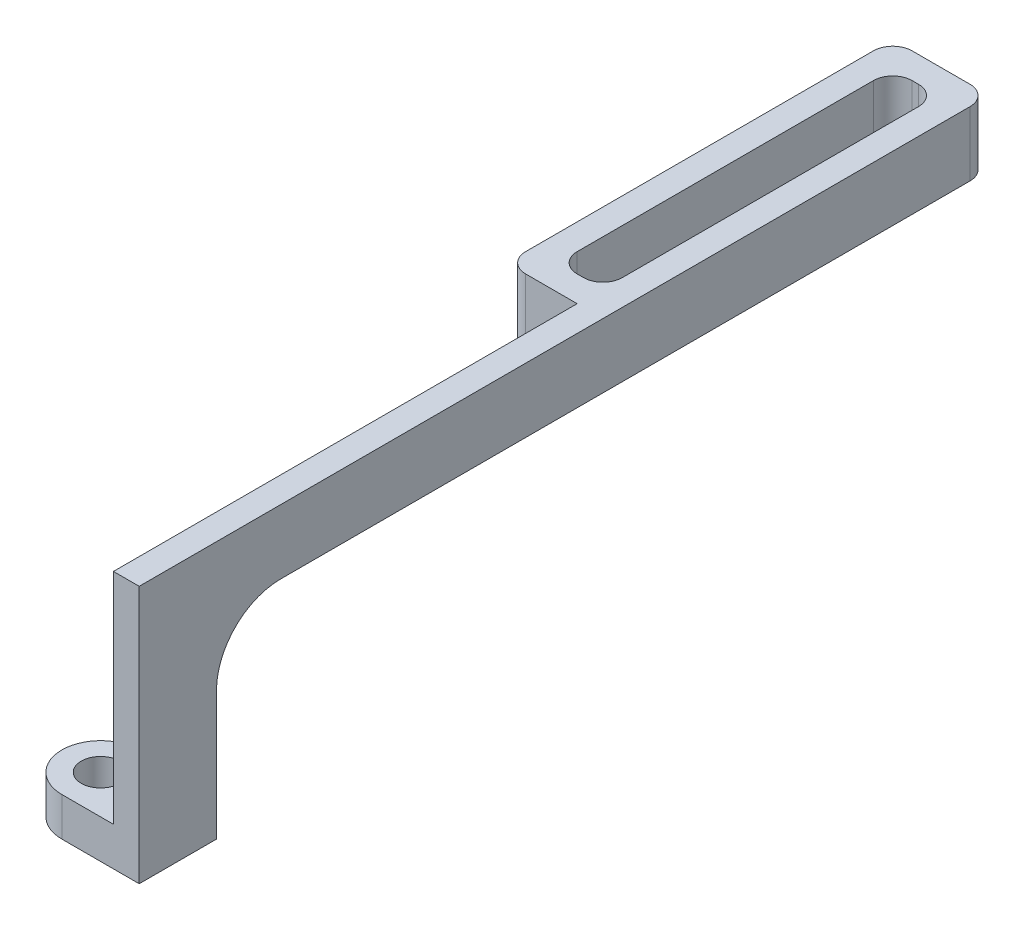
from build123d import *

# Parameters (mm, degrees)
SKETCH_1_R      = 3
SKETCH_1_R_2    = 1.5
EXTRUDE_1_DEPTH = 3
SKETCH_2_W      = 2
SKETCH_2_H      = 6
EXTRUDE_2_DEPTH = 15
SKETCH_3_W      = 3.5
SKETCH_3_H      = 26
EXTRUDE_3_DEPTH = 5
FILLET_1_R      = 5
FILLET_2_R      = 1.5
FILLET_3_R      = 1.5


with BuildPart() as part:
    # 草图1 → 凸台-拉伸1 (new body)
    # profile 1 of 2: a face of its own
    with BuildSketch(Plane(origin=(0, 0, 0), x_dir=(1, 0, 0), z_dir=(0, 1, 0))):
        Circle(SKETCH_1_R)
        with Locations(Location((0, 0, 0), (0, 0, 270))):
            Circle(SKETCH_1_R_2, mode=Mode.SUBTRACT)
    # profile 2 of 2: a face of its own
    with BuildSketch(Plane(origin=(0, 0, 0), x_dir=(1, 0, 0), z_dir=(0, 1, 0))):
        with BuildLine():
            Line((6, 3), (0, 3))
            ThreePointArc((0, 3), (2.121320344, 2.121320344), (3, 0))
            ThreePointArc((3, 0), (2.121320344, -2.121320344), (0, -3))
            Line((0, -3), (6, -3))
            Line((6, -3), (6, 3))
        make_face()
    extrude(amount=EXTRUDE_1_DEPTH)

    # 草图2 → 凸台-拉伸2 (add)
    with BuildSketch(Plane(origin=(0, 0, 0), x_dir=(1, 0, 0), z_dir=(0, 1, 0))):
        with Locations((5, 0)):
            Rectangle(SKETCH_2_W, SKETCH_2_H)
    extrude(amount=EXTRUDE_2_DEPTH)

    # 草图3 → 凸台-拉伸3 (add)
    with BuildSketch(Plane(origin=(0, 15, 0), x_dir=(1, 0, 0), z_dir=(0, 1, 0))):
        Polygon((6, -3), (6, 63), (4, 63), (-1.5, 63), (-1.5, 33), (4, 33), (4, -3), align=None)
        with Locations((2.25, 48)):
            Rectangle(SKETCH_3_W, SKETCH_3_H, mode=Mode.SUBTRACT)
    extrude(amount=EXTRUDE_3_DEPTH)

    # 圆角1
    fillet_1_edges = [part.edges().sort_by_distance(p)[0] for p in [
        (5, 15, -3),
    ]]
    fillet(fillet_1_edges, radius=FILLET_1_R)

    # 圆角2
    fillet_2_edges = [part.edges().sort_by_distance(p)[0] for p in [
        (6, 17.5, -63),
        (-1.5, 17.5, -63),
        (-1.5, 17.5, -33),
        (0.5, 17.5, -35),
        (4, 17.5, -35),
    ]]
    fillet(fillet_2_edges, radius=FILLET_2_R)

    # 圆角3
    fillet_3_edges = [part.edges().sort_by_distance(p)[0] for p in [
        (4, 17.5, -61),
        (0.5, 17.5, -61),
    ]]
    fillet(fillet_3_edges, radius=FILLET_3_R)


solid = part.part
